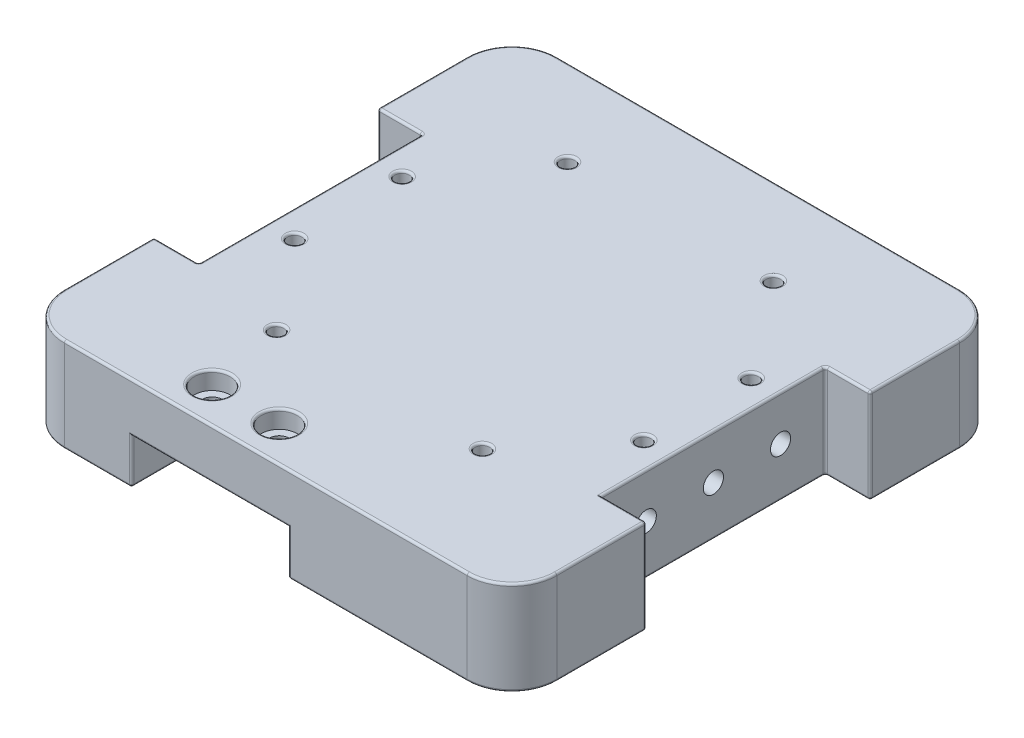
from build123d import *

# Parameters (mm, degrees)
SKETCH2_W                = 110
SKETCH2_H                = 110
BOSS_EXTRUDE2_DEPTH      = 21
FILLET1_R                = 10
SKETCH13_W               = 10
SKETCH13_H               = 50
CUT_EXTRUDE10_DEPTH      = 30
SKETCH20_W               = 35
SKETCH20_H               = 20
CUT_EXTRUDE12_DEPTH      = 10
SKETCH21_R               = 2.25
CUT_EXTRUDE13_DEPTH      = 15
SKETCH47_R               = 4
CUT_EXTRUDE24_DEPTH      = 4
CUT_EXTRUDE11_START      = -90
SKETCH14_R               = 2.25
CUT_EXTRUDE11_DEPTH      = 90
CUT_EXTRUDE_1_DEPTH      = 157.974520225
CUT_EXTRUDE_1_DEPTH_BACK = 157.974520225
SKETCH_1_R               = 1.599999773
SKETCH_1_R_2             = 1.599999951
SKETCH_1_R_3             = 1.59999899
SKETCH_1_R_4             = 1.599999168
SKETCH_1_R_5             = 1.6
FILLET_1_R               = 0.5


with BuildPart() as part:
    # Sketch2 → Boss-Extrude2 (new body)
    with BuildSketch(Plane(origin=(0, 0, 0), x_dir=(1, 0, 0), z_dir=(0, 1, 0))):
        with Locations((55, 55)):
            Rectangle(SKETCH2_W, SKETCH2_H)
    extrude(amount=BOSS_EXTRUDE2_DEPTH)

    # Fillet1
    fillet1_edges = [part.edges().sort_by_distance(p)[0] for p in [
        (0, 10.5, -110),
        (110, 10.5, -110),
        (110, 10.5, 0),
        (0, 10.5, 0),
    ]]
    fillet(fillet1_edges, radius=FILLET1_R)

    # Sketch13 → Cut-Extrude10 (cut)
    with BuildSketch(Plane(origin=(0, 21, 0), x_dir=(1, 0, 0), z_dir=(0, 1, 0))):
        with Locations((5, 55)):
            Rectangle(SKETCH13_W, SKETCH13_H)
        with Locations((105, 55)):
            Rectangle(SKETCH13_W, SKETCH13_H)
    extrude(amount=-CUT_EXTRUDE10_DEPTH, mode=Mode.SUBTRACT)

    # Sketch20 → Cut-Extrude12 (cut)
    with BuildSketch(Plane.XZ):
        with Locations((42.5, -10)):
            Rectangle(SKETCH20_W, SKETCH20_H)
    extrude(amount=-CUT_EXTRUDE12_DEPTH, mode=Mode.SUBTRACT)

    # Sketch21 → Cut-Extrude13 (cut)
    with BuildSketch(Plane(origin=(0, 10, 0), x_dir=(-1, 0, 0), z_dir=(0, -1, 0))):
        with Locations(Location((-50, 8, 0), (0, 0, 90))):
            Circle(SKETCH21_R)
        with Locations(Location((-35, 8, 0), (0, 0, 90))):
            Circle(SKETCH21_R)
    extrude(amount=-CUT_EXTRUDE13_DEPTH, mode=Mode.SUBTRACT)

    # Sketch47 → Cut-Extrude24 (cut)
    with BuildSketch(Plane(origin=(0, 21, 0), x_dir=(1, 0, 0), z_dir=(0, 1, 0))):
        with Locations(Location((50, 8, 0), (0, 0, 270))):
            Circle(SKETCH47_R)
        with Locations(Location((35, 8, 0), (0, 0, 270))):
            Circle(SKETCH47_R)
    extrude(amount=-CUT_EXTRUDE24_DEPTH, mode=Mode.SUBTRACT)

    # Sketch14 → Cut-Extrude11 (cut)
    with BuildSketch(Plane(origin=(100, 0, 0), x_dir=(0, 0, -1), z_dir=(1, 0, 0)).offset(CUT_EXTRUDE11_START)):
        with Locations((40, 11)):
            Circle(SKETCH14_R)
        with Locations((70, 11)):
            Circle(SKETCH14_R)
        with Locations((55, 11)):
            Circle(SKETCH14_R)
    extrude(amount=CUT_EXTRUDE11_DEPTH, mode=Mode.SUBTRACT)

    # 草图1 → 切除-拉伸1 (cut, two sides: drawn at the far end of the back side and taken through both)
    with BuildSketch(Plane(origin=(0, 21, 0), x_dir=(1, 0, 0), z_dir=(0, 1, 0)).offset(-CUT_EXTRUDE_1_DEPTH_BACK)):
        with Locations(Location((93.999999709, 69.448893972, 0), (0, 0, 270))):
            Circle(SKETCH_1_R)
        with Locations(Location((93.999999709, 45.448891909, 0), (0, 0, 270))):
            Circle(SKETCH_1_R_2)
        with Locations(Location((15.999997563, 69.448893972, 0), (0, 0, 270))):
            Circle(SKETCH_1_R_3)
        with Locations(Location((15.999997563, 45.448891909, 0), (0, 0, 270))):
            Circle(SKETCH_1_R_4)
        with Locations(Location((77.65, 90.75, 0), (0, 0, 270))):
            Circle(SKETCH_1_R_5)
        with Locations(Location((31.65, 90.75, 0), (0, 0, 270))):
            Circle(SKETCH_1_R_5)
        with Locations(Location((77.65, 25.75, 0), (0, 0, 270))):
            Circle(SKETCH_1_R_5)
        with Locations(Location((31.65, 25.75, 0), (0, 0, 270))):
            Circle(SKETCH_1_R_5)
    extrude(amount=CUT_EXTRUDE_1_DEPTH + CUT_EXTRUDE_1_DEPTH_BACK, mode=Mode.SUBTRACT)

    # 圆角1
    fillet_1_edges = [part.edges().sort_by_distance(p)[0] for p in [
        (50, 21, -12),
        (35, 21, -12),
        (77.65, 21, -92.35),
        (77.65, 0, -92.35),
        (15.999997563, 21, -47.048891077),
        (15.999997563, 0, -47.048891077),
        (55, 0, -110),
        (15.999997563, 21, -71.048892962),
        (15.999997563, 0, -71.048892962),
        (93.999999709, 21, -47.04889186),
        (93.999999709, 0, -47.04889186),
        (55, 21, -110),
        (31.65, 21, -92.35),
        (31.65, 0, -92.35),
        (31.65, 21, -27.35),
        (31.65, 0, -27.35),
        (77.65, 21, -27.35),
        (77.65, 0, -27.35),
        (93.999999709, 21, -71.048893745),
        (93.999999709, 0, -71.048893745),
        (0, 0, -90),
        (110, 0, -20),
        (17.5, 0, 0),
        (2.928932188, 0, -2.928932188),
        (2.928932188, 0, -107.071067812),
        (107.071067812, 0, -2.928932188),
        (107.071067812, 0, -107.071067812),
        (110, 21, -20),
        (0, 21, -90),
        (55, 21, 0),
        (2.928932188, 21, -2.928932188),
        (2.928932188, 21, -107.071067812),
        (107.071067812, 21, -2.928932188),
        (107.071067812, 21, -107.071067812),
        (110, 0, -90),
        (0, 0, -20),
        (105, 0, -80),
        (100, 0, -55),
        (105, 0, -30),
        (5, 0, -30),
        (10, 0, -55),
        (5, 0, -80),
        (110, 21, -90),
        (0, 21, -20),
        (0, 10.5, -30),
        (0, 10.5, -80),
        (10, 10.5, -80),
        (10, 10.5, -30),
        (5, 21, -30),
        (10, 21, -55),
        (5, 21, -80),
        (110, 10.5, -80),
        (110, 10.5, -30),
        (100, 10.5, -80),
        (105, 21, -80),
        (100, 21, -55),
        (105, 21, -30),
        (80, 0, 0),
        (42.5, 10, 0),
        (25, 5, 0),
        (60, 5, 0),
        (25, 0, -10),
        (42.5, 0, -20),
        (60, 0, -10),
    ]]
    fillet(fillet_1_edges, radius=FILLET_1_R)


solid = part.part
